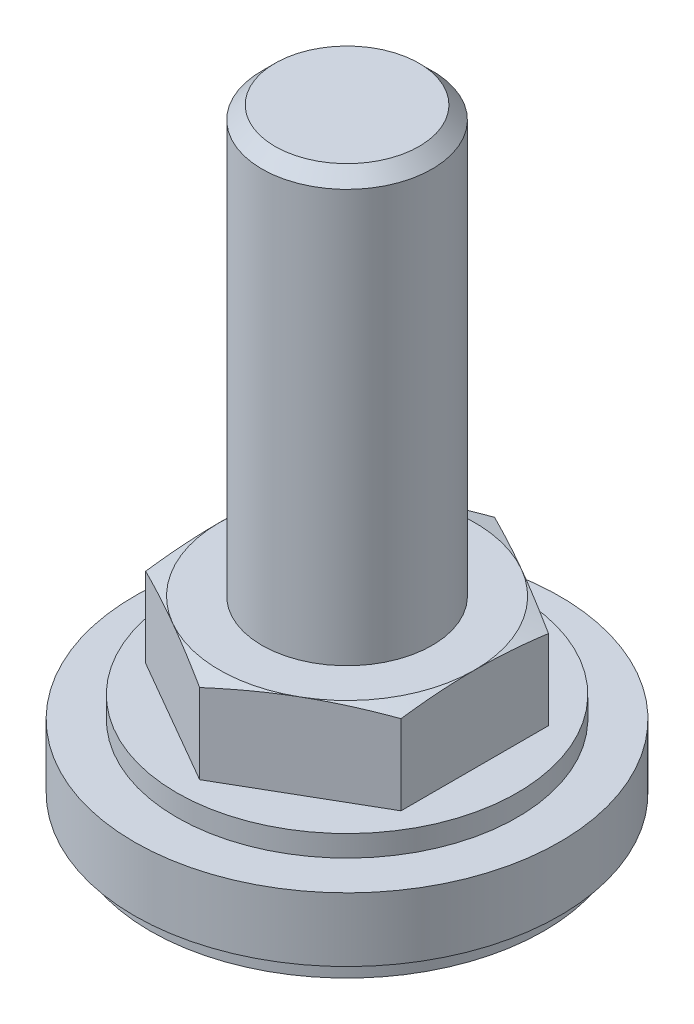
from build123d import *

# Parameters (mm, degrees)
SKETCH2_R          = 17
CUT_EXTRUDE1_DEPTH = 10


with BuildPart() as part:
    # Sketch1 → Revolve1 (revolve)
    with BuildSketch(Plane.XY, mode=Mode.PRIVATE) as revolve1_sk:
        Polygon((0, 50), (6.773, 50), (8, 48.773), (8, 10), (12, 10), (15, 9.196152423), (15, 2), (16, 2), (16, 0), (20, 0), (20, -6), (18.5, -6), (18.5, -8), (0, -8), align=None)
    revolve(revolve1_sk.sketch.rotate(Axis((0, -8, 0), (0, 1, 0)), 270), axis=Axis((0, -8, 0), (0, 1, 0)))

    # Sketch2 → Cut-Extrude1 (cut)
    with BuildSketch(Plane(origin=(0, 2, 0), x_dir=(1, 0, 0), z_dir=(0, 1, 0))):
        Circle(SKETCH2_R)
        Polygon((-12, 6.92820323), (-12, -6.92820323), (0, -13.856406461), (12, -6.92820323), (12, 6.92820323), (0, 13.856406461), align=None, mode=Mode.SUBTRACT)
    extrude(amount=CUT_EXTRUDE1_DEPTH, mode=Mode.SUBTRACT)


solid = part.part
